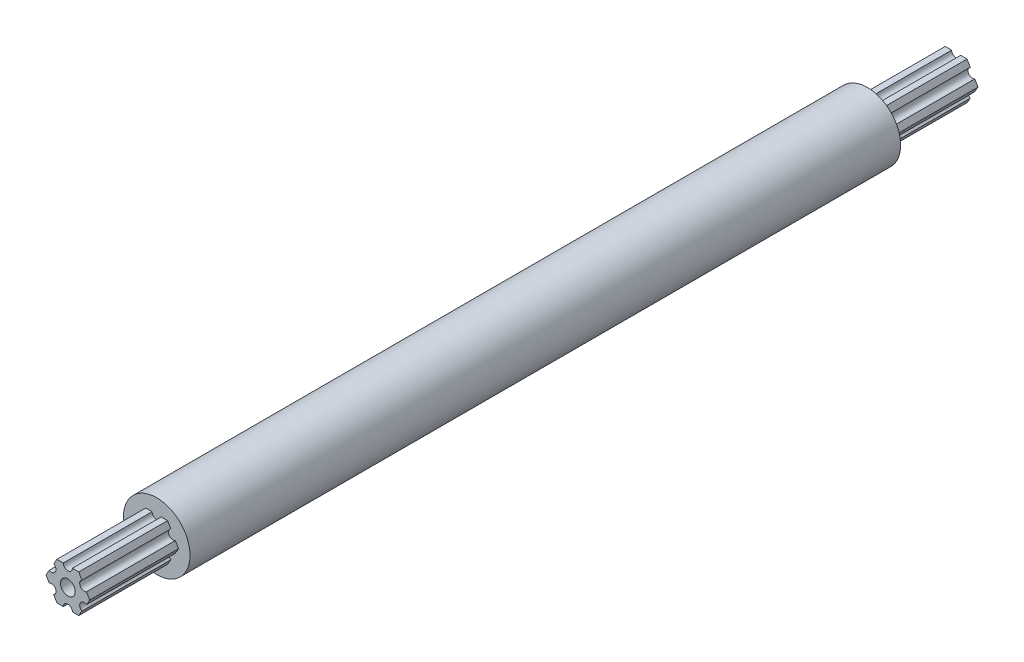
from build123d import *

# Parameters (mm, degrees)
SKETCH1_R           = 2.54
BOSS_EXTRUDE1_DEPTH = 304.8
SKETCH2_R           = 11.43
BOSS_EXTRUDE2_DEPTH = 121.92


with BuildPart() as part:
    # Sketch1 → Boss-Extrude1 (new body)
    with BuildSketch(Plane.XY):
        with BuildLine():
            Line((7.493, 0), (6.396528537, 1.899144284))
            ThreePointArc((6.396528537, 1.899144284), (4.274330108, 2.467785639), (4.842971463, 4.589984067))
            Line((4.842971463, 4.589984067), (3.7465, 6.489128351))
            Line((3.7465, 6.489128351), (1.553557073, 6.489128351))
            ThreePointArc((1.553557073, 6.489128351), (0, 4.935571277), (-1.553557073, 6.489128351))
            Line((-1.553557073, 6.489128351), (-3.7465, 6.489128351))
            Line((-3.7465, 6.489128351), (-4.842971463, 4.589984067))
            ThreePointArc((-4.842971463, 4.589984067), (-4.274330108, 2.467785639), (-6.396528537, 1.899144284))
            Line((-6.396528537, 1.899144284), (-7.493, 0))
            Line((-7.493, 0), (-6.396528537, -1.899144284))
            ThreePointArc((-6.396528537, -1.899144284), (-4.274330108, -2.467785639), (-4.842971463, -4.589984067))
            Line((-4.842971463, -4.589984067), (-3.7465, -6.489128351))
            Line((-3.7465, -6.489128351), (-1.553557073, -6.489128351))
            ThreePointArc((-1.553557073, -6.489128351), (0, -4.935571277), (1.553557073, -6.489128351))
            Line((1.553557073, -6.489128351), (3.7465, -6.489128351))
            Line((3.7465, -6.489128351), (4.842971463, -4.589984067))
            ThreePointArc((4.842971463, -4.589984067), (4.274330108, -2.467785639), (6.396528537, -1.899144284))
            Line((6.396528537, -1.899144284), (7.493, 0))
        make_face()
        with Locations(Location((0, 0, 0), (0, 0, 180))):
            Circle(SKETCH1_R, mode=Mode.SUBTRACT)
    extrude(amount=BOSS_EXTRUDE1_DEPTH)

    # Sketch2 → Boss-Extrude2 (add, symmetric)
    with BuildSketch(Plane(origin=(0, 0, 152.4), x_dir=(-1, 0, 0), z_dir=(0, 0, -1))):
        with Locations(Location((0, 0, 0), (0, 0, 180))):
            Circle(SKETCH2_R)
    extrude(amount=BOSS_EXTRUDE2_DEPTH, both=True)


solid = part.part
